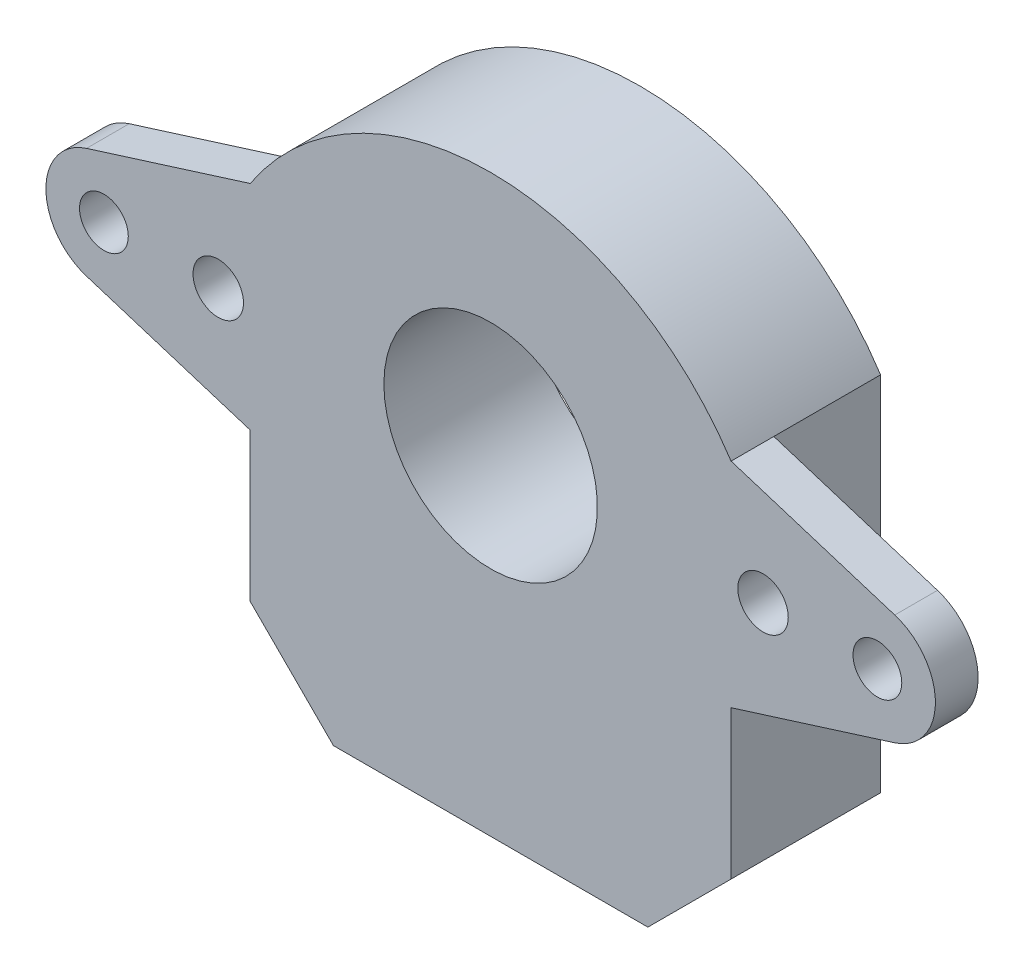
from build123d import *

# Parameters (mm, degrees)
BOSS_EXTRUDE1_DEPTH = 8.89
SKETCH2_R           = 6.35
CUT_EXTRUDE1_DEPTH  = 27.197420728
SKETCH3_R           = 1.5
SKETCH3_R_2         = 1.45
BOSS_EXTRUDE2_DEPTH = 2.54


with BuildPart() as part:
    # Sketch1 → Boss-Extrude1 (new body)
    with BuildSketch(Plane.XY):
        with BuildLine():
            Line((-9.350252532, -14.130551756), (9.350252532, -14.130551756))
            Line((9.350252532, -14.130551756), (14.3, -9.180804288))
            Line((14.3, -9.180804288), (14.3, 12.34601478))
            ThreePointArc((14.3, 12.34601478), (0, 20.069448244), (-14.3, 12.34601478))
            Line((-14.3, 12.34601478), (-14.3, -9.180804288))
            Line((-14.3, -9.180804288), (-9.350252532, -14.130551756))
        make_face()
    extrude(amount=BOSS_EXTRUDE1_DEPTH)

    # Sketch2 → Cut-Extrude1 (cut, through all)
    with BuildSketch(Plane(origin=(0, 0, 0), x_dir=(-1, 0, 0), z_dir=(0, 0, -1))):
        with Locations((0, 5.99601478)):
            Circle(SKETCH2_R)
    extrude(amount=-CUT_EXTRUDE1_DEPTH, mode=Mode.SUBTRACT)

    # Sketch3 → Boss-Extrude2 (add)
    # profile 1 of 2: a face of its own
    with BuildSketch(Plane.XY.offset(8.89)):
        with BuildLine():
            Line((-14.3, 12.34601478), (-24.034198127, 9.287357095))
            ThreePointArc((-24.034198127, 9.287357095), (-26.45, 5.99601478), (-24.034198127, 2.704672465))
            Line((-24.034198127, 2.704672465), (-14.3, -0.35398522))
            Line((-14.3, -0.35398522), (-14.3, 12.34601478))
        make_face()
        with Locations((-16.2, 5.99601478)):
            Circle(SKETCH3_R, mode=Mode.SUBTRACT)
        with Locations((-23, 5.99601478)):
            Circle(SKETCH3_R_2, mode=Mode.SUBTRACT)
    # profile 2 of 2: a face of its own
    with BuildSketch(Plane.XY.offset(8.89)):
        with BuildLine():
            Line((14.3, 12.34601478), (14.3, -0.35398522))
            Line((14.3, -0.35398522), (24.034198127, 2.704672465))
            ThreePointArc((24.034198127, 2.704672465), (26.45, 5.99601478), (24.034198127, 9.287357095))
            Line((24.034198127, 9.287357095), (14.3, 12.34601478))
        make_face()
        with Locations((16.2, 5.99601478)):
            Circle(SKETCH3_R, mode=Mode.SUBTRACT)
        with Locations((23, 5.99601478)):
            Circle(SKETCH3_R_2, mode=Mode.SUBTRACT)
    extrude(amount=-BOSS_EXTRUDE2_DEPTH)


solid = part.part
